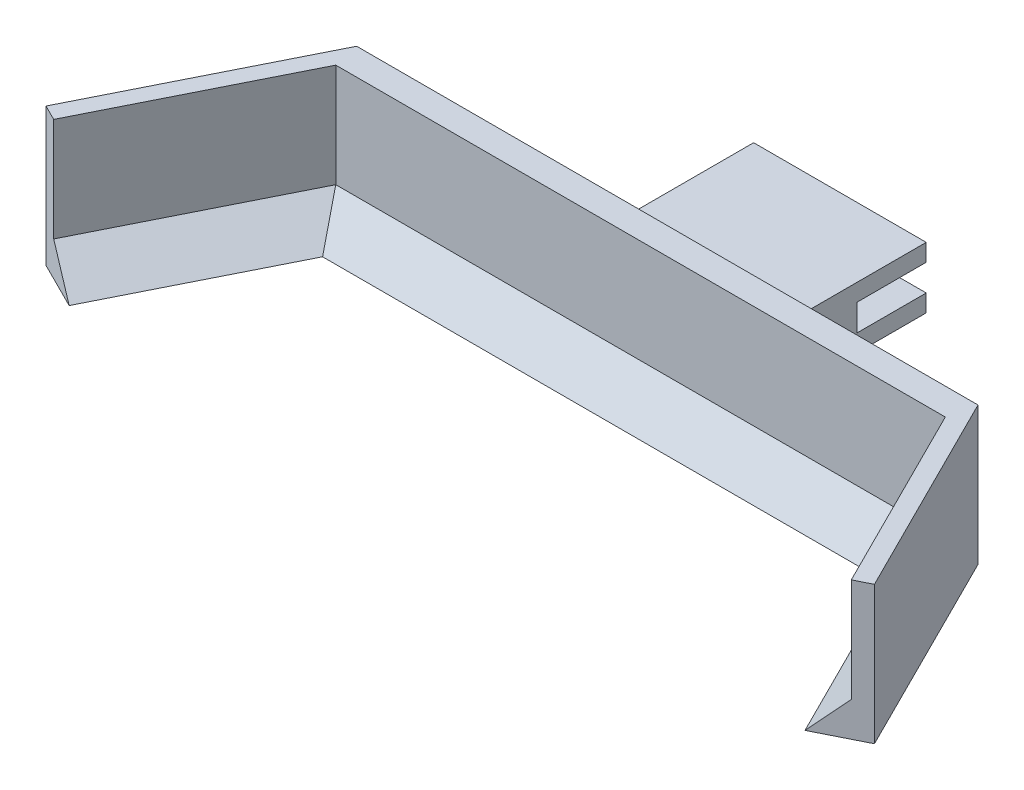
from build123d import *

# Parameters (mm, degrees)
BOSS_EXTRUDE1_DEPTH = 10
DRAFT1_ANGLE        = 45
BOSS_EXTRUDE2_DEPTH = 30
SKETCH6_W           = 50
SKETCH6_H           = 17.7
BOSS_EXTRUDE3_DEPTH = 50
SKETCH7_W           = 50
SKETCH7_H           = 7.7
CUT_EXTRUDE4_DEPTH  = 20


with BuildPart() as part:
    # Sketch2 → Boss-Extrude1 (new body)
    with BuildSketch(Plane(origin=(0, 0, 0), x_dir=(1, 0, 0), z_dir=(0, 1, 0))):
        Polygon((-90, 5), (90, 5), (120, -55), (115.527864045, -57.236067977), (88.291796068, -2.763932023), (-88.291796068, -2.763932023), (-115.527864045, -57.236067977), (-120, -55), align=None)
    extrude(amount=BOSS_EXTRUDE1_DEPTH)

    # Draft1
    draft1_faces = [part.faces().sort_by_distance(p)[0] for p in [
        (101.909830056, 5, 30),
        (0, 5, 2.763932023),
        (-101.909830056, 5, 30),
    ]]
    draft(draft1_faces, Plane.ZX.offset(10), DRAFT1_ANGLE)

    # Sketch5 → Boss-Extrude2 (add)
    with BuildSketch(Plane(origin=(0, 10, 0), x_dir=(1, 0, 0), z_dir=(0, 1, 0))):
        Polygon((-120, -55), (-90, 5), (90, 5), (120, -55), (115.527864045, -57.236067977), (88.291796068, -2.763932023), (-88.291796068, -2.763932023), (-115.527864045, -57.236067977), align=None)
    extrude(amount=BOSS_EXTRUDE2_DEPTH)

    # Sketch6 → Boss-Extrude3 (add)
    with BuildSketch(Plane(origin=(0, 0, -5), x_dir=(-1, 0, 0), z_dir=(0, 0, -1))):
        with Locations((0, 14.45)):
            Rectangle(SKETCH6_W, SKETCH6_H)
    extrude(amount=BOSS_EXTRUDE3_DEPTH)

    # Sketch7 → Cut-Extrude4 (cut)
    with BuildSketch(Plane(origin=(0, 0, -55), x_dir=(-1, 0, 0), z_dir=(0, 0, -1))):
        with Locations((0, 14.45)):
            Rectangle(SKETCH7_W, SKETCH7_H)
    extrude(amount=-CUT_EXTRUDE4_DEPTH, mode=Mode.SUBTRACT)


solid = part.part
